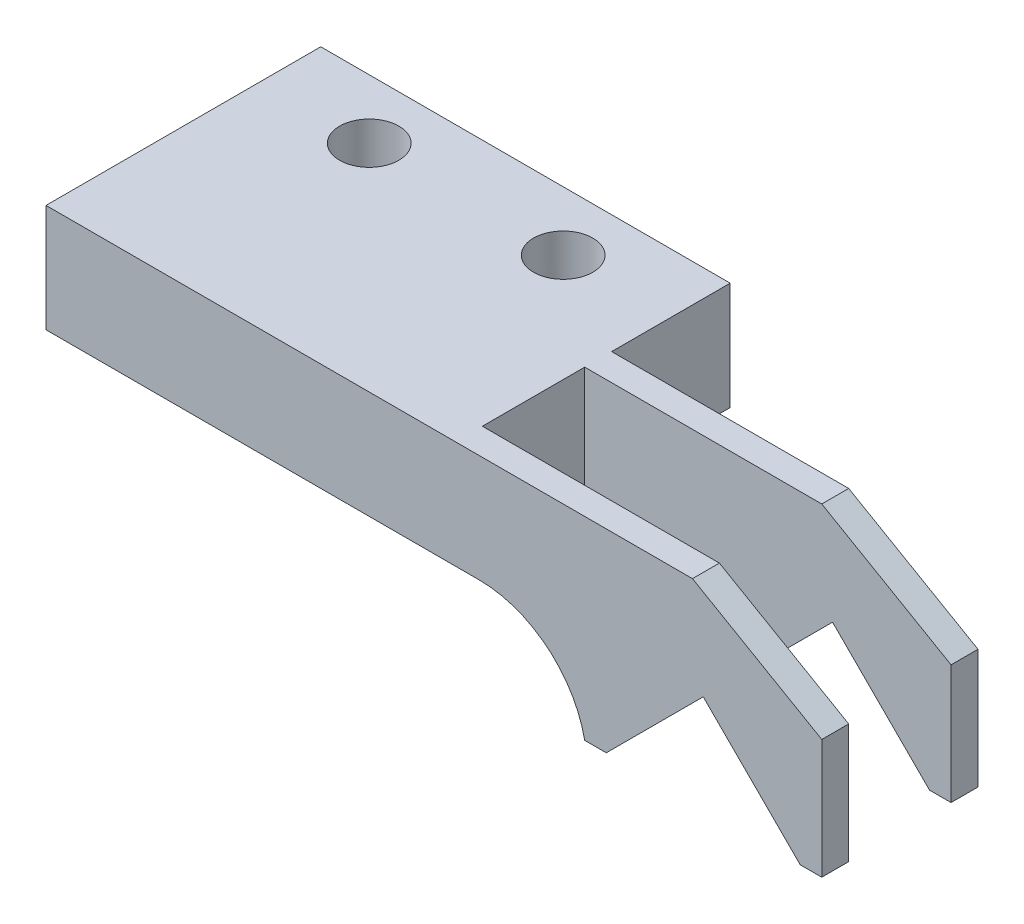
from build123d import *

# Parameters (mm, degrees)
BASE_EXTRUSION_DEPTH    = 25.5
ESQUISSE2_W             = 56.002380091
ESQUISSE2_H             = 22.364539332
ENL_V_MAT_EXTRU_1_DEPTH = 79.474518157
ESQUISSE3_W             = 40.935077574
ESQUISSE3_H             = 9.5
ENL_V_MAT_EXTRU_2_DEPTH = 79.474518157
ESQUISSE4_R             = 5
ENL_V_MAT_EXTRU_3_DEPTH = 6
ESQUISSE5_R             = 2.75
ENL_V_MAT_EXTRU_4_DEPTH = 6


with BuildPart() as part:
    # Esquisse1 → Base-Extrusion (new body)
    with BuildSketch(Plane.XY):
        with BuildLine():
            Line((0, 0), (0, 10))
            Line((0, 10), (60, 10))
            Line((60, 10), (72, 3.07179677))
            Line((72, 3.07179677), (72, -8))
            Line((72, -8), (70, -8))
            Line((70, -8), (61, 1))
            Line((61, 1), (52, -8))
            Line((52, -8), (50, -8))
            ThreePointArc((50, -8), (46.526596349, -2.254033308), (40.202041029, 0))
            Line((40.202041029, 0), (0, 0))
        make_face()
    extrude(amount=BASE_EXTRUSION_DEPTH)

    # Esquisse2 → Enlèv. mat.-Extru.1 (cut, through all)
    with BuildSketch(Plane(origin=(0, 10, 0), x_dir=(-1, 0, 0), z_dir=(0, 1, 0))):
        with Locations((-66.001190046, -0.182269666)):
            Rectangle(ESQUISSE2_W, ESQUISSE2_H)
    extrude(amount=-ENL_V_MAT_EXTRU_1_DEPTH, mode=Mode.SUBTRACT)

    # Esquisse3 → Enlèv. mat.-Extru.2 (cut, through all)
    with BuildSketch(Plane(origin=(0, 10, 0), x_dir=(-1, 0, 0), z_dir=(0, 1, 0))):
        with Locations((-58.467538787, 18.25)):
            Rectangle(ESQUISSE3_W, ESQUISSE3_H)
    extrude(amount=-ENL_V_MAT_EXTRU_2_DEPTH, mode=Mode.SUBTRACT)

    # Esquisse4 → Enlèv. mat.-Extru.3 (cut)
    with BuildSketch(Plane.XZ):
        with Locations(Location((10, 5.5, 0), (0, 0, 270))):
            Circle(ESQUISSE4_R)
        with Locations(Location((28, 5.5, 0), (0, 0, 270))):
            Circle(ESQUISSE4_R)
    extrude(amount=-ENL_V_MAT_EXTRU_3_DEPTH, mode=Mode.SUBTRACT)

    # Esquisse5 → Enlèv. mat.-Extru.4 (cut)
    with BuildSketch(Plane.XZ.offset(-6)):
        with Locations(Location((28, 5.5, 0), (0, 0, 270))):
            Circle(ESQUISSE5_R)
        with Locations(Location((10, 5.5, 0), (0, 0, 270))):
            Circle(ESQUISSE5_R)
    extrude(amount=-ENL_V_MAT_EXTRU_4_DEPTH, mode=Mode.SUBTRACT)


solid = part.part
